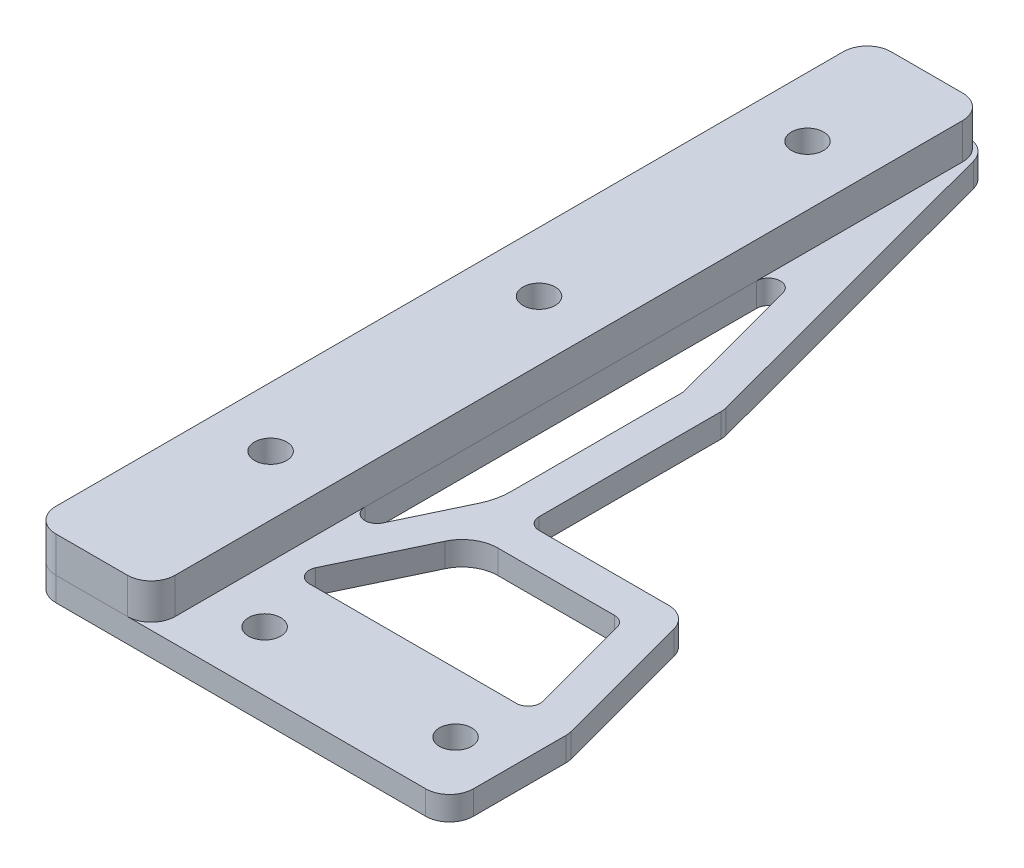
from build123d import *
from OCP.BRepFilletAPI import BRepFilletAPI_MakeFillet

# Parameters (mm, degrees)
EXTRUDE_1_DEPTH     = 2
CUT_EXTRUDE_1_DEPTH = 3
SKETCH_3_R          = 1.35
CUT_EXTRUDE_2_DEPTH = 79.287930104
EXTRUDE_2_DEPTH     = 2
CUT_EXTRUDE_3_DEPTH = 10
FILLET_2_R          = 2
FILLET_3_R1         = 1
FILLET_3_R2         = 3
FILLET_3_R3         = 5
SKETCH_8_W          = 10
SKETCH_8_H          = 70
SKETCH_8_R          = 1.35
EXTRUDE_4_DEPTH     = 3
FILLET_5_R          = 2


with BuildPart() as part:
    # 草图1 → 凸台-拉伸1 (new body)
    with BuildSketch(Plane(origin=(0, 0, 0), x_dir=(1, 0, 0), z_dir=(0, 1, 0))):
        Polygon((0, 0), (35, 0), (35, 10), (10, 70), (0, 70), align=None)
    extrude(amount=EXTRUDE_1_DEPTH)

    # 草图2 → 切除-拉伸1 (cut)
    with BuildSketch(Plane(origin=(0, 2, 0), x_dir=(1, 0, 0), z_dir=(0, 1, 0))):
        Polygon((35, 10), (10, 10), (10, 70), align=None)
    extrude(amount=-CUT_EXTRUDE_1_DEPTH, mode=Mode.SUBTRACT)

    # 草图3 → 切除-拉伸2 (cut, through all)
    with BuildSketch(Plane(origin=(0, 2, 0), x_dir=(1, 0, 0), z_dir=(0, 1, 0))):
        with Locations(Location((30.5, 5, 0), (0, 0, 270))):
            Circle(SKETCH_3_R)
        with Locations(Location((14.5, 5, 0), (0, 0, 270))):
            Circle(SKETCH_3_R)
        with Locations(Location((5, 15, 0), (0, 0, 270))):
            Circle(SKETCH_3_R)
        with Locations(Location((5, 60, 0), (0, 0, 270))):
            Circle(SKETCH_3_R)
        with Locations(Location((5, 37.5, 0), (0, 0, 270))):
            Circle(SKETCH_3_R)
    extrude(amount=-CUT_EXTRUDE_2_DEPTH, mode=Mode.SUBTRACT)

    # 草图4 → 凸台-拉伸2 (add)
    with BuildSketch(Plane(origin=(0, 2, 0), x_dir=(1, 0, 0), z_dir=(0, 1, 0))):
        Polygon((10, 70), (18, 40), (18, 23.5), (31.4, 23.5), (35, 10), (10, 10), align=None)
    extrude(amount=-EXTRUDE_2_DEPTH)

    # 草图5 → 切除-拉伸3 (cut)
    with BuildSketch(Plane(origin=(0, 2, 0), x_dir=(1, 0, 0), z_dir=(0, 1, 0))):
        Polygon((15, 39.606868978), (10, 58.356868978), (10, 13.488911005), (15, 23.988911005), align=None)
        Polygon((16.661386193, 20.5), (11.661386193, 10), (31.895165061, 10), (29.095165061, 20.5), align=None)
    extrude(amount=-CUT_EXTRUDE_3_DEPTH, mode=Mode.SUBTRACT)

    # 圆角2
    fillet_2_edges = [part.edges().sort_by_distance(p)[0] for p in [
        (18, 1, -40),
        (31.4, 1, -23.5),
        (0, 1, -70),
        (10, 1, -70),
        (35, 1, -10),
        (35, 1, 0),
        (0, 1, 0),
    ]]
    fillet(fillet_2_edges, radius=FILLET_2_R)

    # 圆角3: one fillet with a radius per group of edges: ONE call of the kernel's fillet builder (fillet() takes one radius for all edges)
    fillet_3_edges_1 = [part.edges().sort_by_distance(p)[0] for p in [
        (15, 1, -39.606868978),
        (31.895165061, 1, -10),
        (29.095165061, 1, -20.5),
        (11.661386193, 1, -10),
        (10, 1, -58.356868978),
        (10, 1, -13.488911005),
        (18, 1, -23.5),
    ]]
    fillet_3_edges_2 = [part.edges().sort_by_distance(p)[0] for p in [
        (16.661386193, 1, -20.5),
    ]]
    fillet_3_edges_3 = [part.edges().sort_by_distance(p)[0] for p in [
        (15, 1, -23.988911005),
    ]]
    fillet_3 = BRepFilletAPI_MakeFillet(part.part.solid().wrapped)
    for e in fillet_3_edges_1:
        fillet_3.Add(FILLET_3_R1, e.wrapped)
    for e in fillet_3_edges_2:
        fillet_3.Add(FILLET_3_R2, e.wrapped)
    for e in fillet_3_edges_3:
        fillet_3.Add(FILLET_3_R3, e.wrapped)
    add(Compound.cast(fillet_3.Shape()), mode=Mode.REPLACE)


with BuildPart() as body_2:
    # 草图8 → 凸台-拉伸4 (new body)
    with BuildSketch(Plane(origin=(0, 2, 0), x_dir=(1, 0, 0), z_dir=(0, 1, 0))):
        with Locations((5, 35)):
            Rectangle(SKETCH_8_W, SKETCH_8_H)
        with Locations(Location((5, 15, 0), (0, 0, 270))):
            Circle(SKETCH_8_R, mode=Mode.SUBTRACT)
        with Locations(Location((5, 37.5, 0), (0, 0, 270))):
            Circle(SKETCH_8_R, mode=Mode.SUBTRACT)
        with Locations(Location((5, 60, 0), (0, 0, 270))):
            Circle(SKETCH_8_R, mode=Mode.SUBTRACT)
    extrude(amount=EXTRUDE_4_DEPTH)

    # 圆角5
    fillet_5_edges = [body_2.edges().sort_by_distance(p)[0] for p in [
        (0, 3.5, -70),
        (10, 3.5, -70),
        (10, 3.5, 0),
        (0, 3.5, 0),
    ]]
    fillet(fillet_5_edges, radius=FILLET_5_R)


solid = Compound([part.part, body_2.part])
